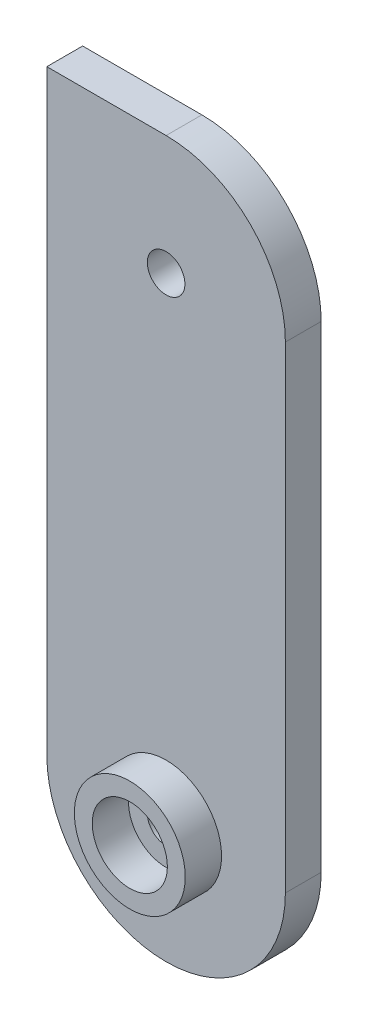
from build123d import *

# Parameters (mm, degrees)
BOSS_EXTRUDE1_DEPTH = 3
SKETCH2_R           = 4.65
SKETCH2_R_2         = 3.15
BOSS_EXTRUDE2_DEPTH = 3.044394089
SKETCH3_R           = 1.575
CUT_EXTRUDE1_DEPTH  = 6.044394089
SKETCH4_R           = 1.575
CUT_EXTRUDE2_DEPTH  = 12


with BuildPart() as part:
    # Sketch1 → Boss-Extrude1 (new body)
    with BuildSketch(Plane.XY):
        with BuildLine():
            Line((-31.25, 76.808826039), (-31.25, 26.808826039))
            ThreePointArc((-31.25, 26.808826039), (-21.25, 16.808826039), (-11.25, 26.808826039))
            Line((-11.25, 26.808826039), (-11.25, 66.808826039))
            ThreePointArc((-11.25, 66.808826039), (-14.178932188, 73.879893851), (-21.25, 76.808826039))
            Line((-21.25, 76.808826039), (-31.25, 76.808826039))
        make_face()
    extrude(amount=BOSS_EXTRUDE1_DEPTH)

    # Sketch2 → Boss-Extrude2 (add)
    with BuildSketch(Plane.XY.offset(3)):
        with Locations((-21.25, 26.808826039)):
            Circle(SKETCH2_R)
        with Locations((-21.25, 26.808826039)):
            Circle(SKETCH2_R_2, mode=Mode.SUBTRACT)
    extrude(amount=BOSS_EXTRUDE2_DEPTH)

    # Sketch3 → Cut-Extrude1 (cut)
    with BuildSketch(Plane(origin=(0, 0, 0), x_dir=(-1, 0, 0), z_dir=(0, 0, -1))):
        with Locations((21.25, 26.808826039)):
            Circle(SKETCH3_R)
    extrude(amount=-CUT_EXTRUDE1_DEPTH, mode=Mode.SUBTRACT)

    # Sketch4 → Cut-Extrude2 (cut)
    with BuildSketch(Plane(origin=(0, 0, 0), x_dir=(-1, 0, 0), z_dir=(0, 0, -1))):
        with Locations((21.25, 66.808826039)):
            Circle(SKETCH4_R)
    extrude(amount=-CUT_EXTRUDE2_DEPTH, mode=Mode.SUBTRACT)


solid = part.part
